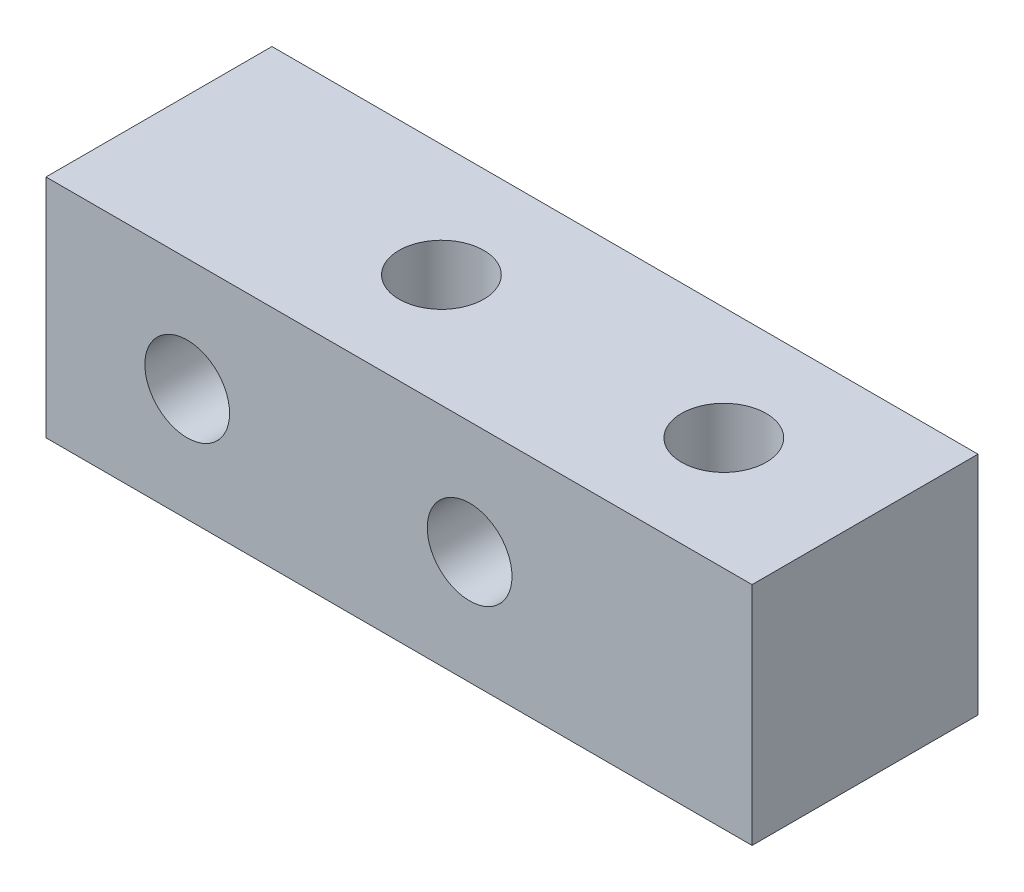
from build123d import *

# Parameters (mm, degrees)
SKETCH_1_W          = 25
SKETCH_1_H          = 8
EXTRUDE_1_DEPTH     = 8
SKETCH_2_R          = 1.5
CUT_EXTRUDE_1_DEPTH = 8
SKETCH_3_R          = 1.5
CUT_EXTRUDE_2_DEPTH = 8


with BuildPart() as part:
    # 草图1 → 凸台-拉伸1 (new body)
    with BuildSketch(Plane(origin=(0, 0, 0), x_dir=(1, 0, 0), z_dir=(0, 1, 0))):
        Rectangle(SKETCH_1_W, SKETCH_1_H)
    extrude(amount=EXTRUDE_1_DEPTH)

    # 草图2 → 切除-拉伸1 (cut)
    with BuildSketch(Plane(origin=(0, 8, 0), x_dir=(1, 0, 0), z_dir=(0, 1, 0))):
        with Locations(Location((7.5, 0, 0), (0, 0, 270))):
            Circle(SKETCH_2_R)
        with Locations(Location((-2.5, 0, 0), (0, 0, 270))):
            Circle(SKETCH_2_R)
    extrude(amount=-CUT_EXTRUDE_1_DEPTH, mode=Mode.SUBTRACT)

    # 草图3 → 切除-拉伸2 (cut)
    with BuildSketch(Plane.XY.offset(4)):
        with Locations((-7.5, 4)):
            Circle(SKETCH_3_R)
        with Locations((2.5, 4)):
            Circle(SKETCH_3_R)
    extrude(amount=-CUT_EXTRUDE_2_DEPTH, mode=Mode.SUBTRACT)


solid = part.part
